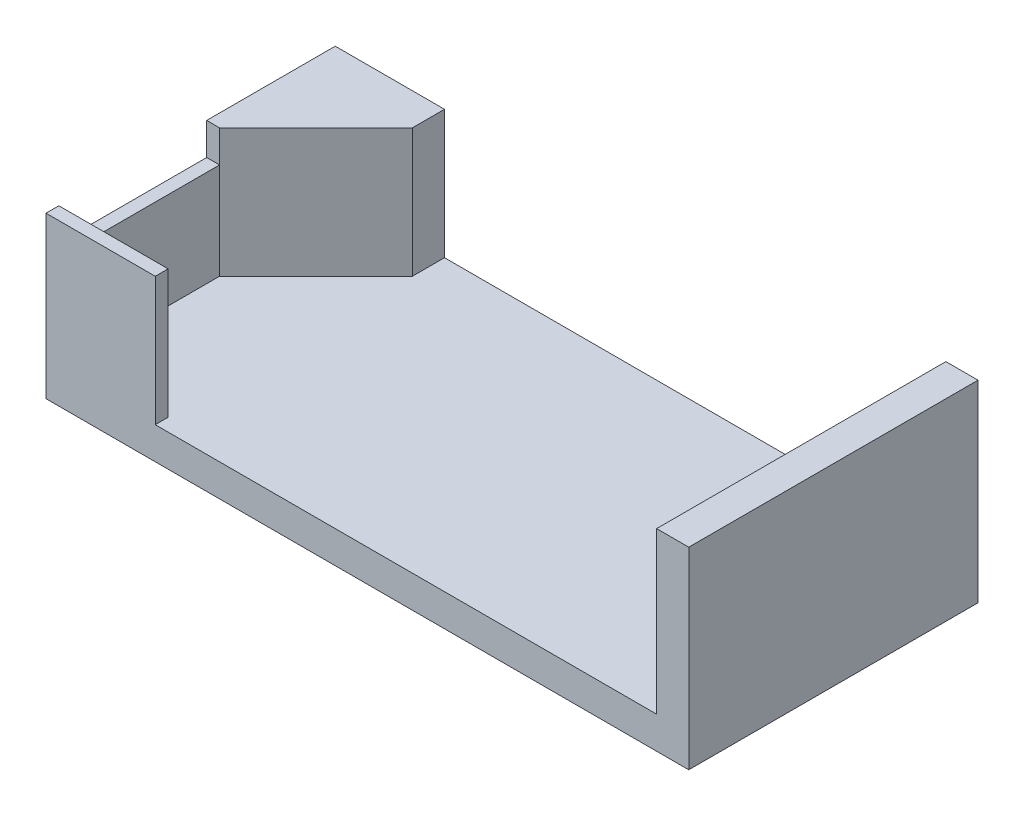
from build123d import *

# Parameters (mm, degrees)
SKETCH1_W           = 100
SKETCH1_H           = 45
BOSS_EXTRUDE1_DEPTH = 5
SKETCH1_4_W         = 5
SKETCH1_4_H         = 45
BOSS_EXTRUDE2_DEPTH = 25
SKETCH1_5_W         = 17
SKETCH1_5_H         = 2
BOSS_EXTRUDE3_DEPTH = 20
BOSS_EXTRUDE4_DEPTH = 20
SKETCH1_8_W         = 2
SKETCH1_8_H         = 23
BOSS_EXTRUDE5_DEPTH = 15


with BuildPart() as part:
    # Sketch1 → Boss-Extrude1 (new body)
    with BuildSketch(Plane(origin=(0, 0, 0), x_dir=(1, 0, 0), z_dir=(0, 1, 0))):
        Rectangle(SKETCH1_W, SKETCH1_H)
    extrude(amount=-BOSS_EXTRUDE1_DEPTH)

    # Sketch1<4> → Boss-Extrude2 (add)
    with BuildSketch(Plane(origin=(0, 0, 0), x_dir=(1, 0, 0), z_dir=(0, 1, 0))):
        with Locations((47.5, 0)):
            Rectangle(SKETCH1_4_W, SKETCH1_4_H)
    extrude(amount=BOSS_EXTRUDE2_DEPTH)

    # Sketch1<5> → Boss-Extrude3 (add)
    with BuildSketch(Plane(origin=(0, 0, 0), x_dir=(1, 0, 0), z_dir=(0, 1, 0))):
        with Locations((-41.5, -21.5)):
            Rectangle(SKETCH1_5_W, SKETCH1_5_H)
    extrude(amount=BOSS_EXTRUDE3_DEPTH)

    # Sketch1<6> → Boss-Extrude4 (add)
    with BuildSketch(Plane(origin=(0, 0, 0), x_dir=(1, 0, 0), z_dir=(0, 1, 0))):
        Polygon((-50, 2.5), (-48, 2.5), (-33, 17.5), (-33, 22.5), (-50, 22.5), align=None)
    extrude(amount=BOSS_EXTRUDE4_DEPTH)

    # Sketch1<8> → Boss-Extrude5 (add)
    with BuildSketch(Plane(origin=(0, 0, 0), x_dir=(1, 0, 0), z_dir=(0, 1, 0))):
        with Locations((-49, -9)):
            Rectangle(SKETCH1_8_W, SKETCH1_8_H)
    extrude(amount=BOSS_EXTRUDE5_DEPTH)


solid = part.part
